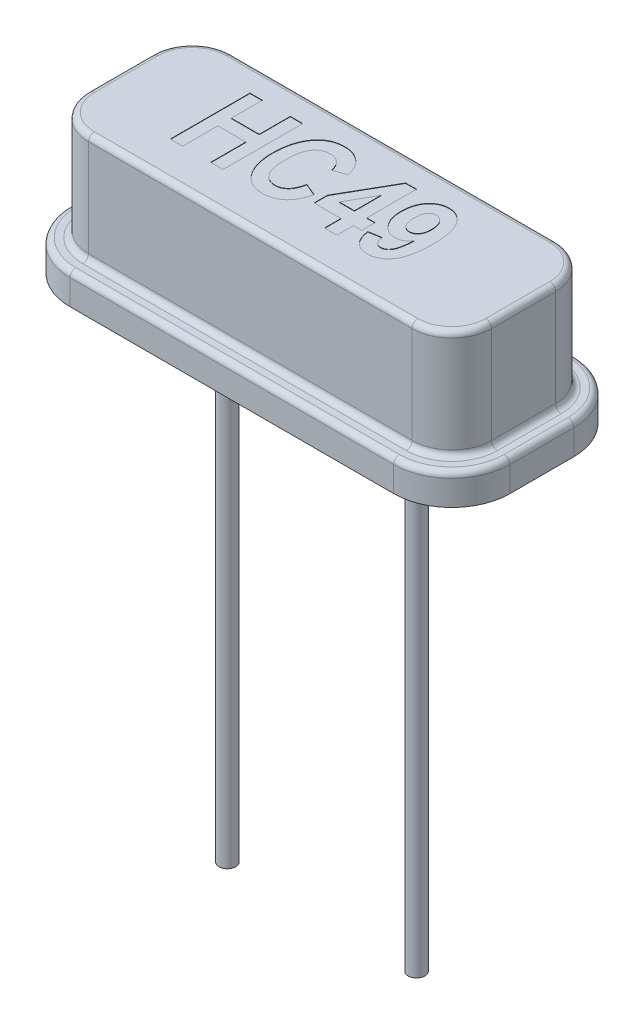
from build123d import *

# Parameters (mm, degrees)
BOSS_EXTRUDE1_DEPTH = 0.8
BOSS_EXTRUDE2_DEPTH = 2.8
FILLET1_R           = 0.15
SKETCH3_R           = 0.215
BOSS_EXTRUDE3_DEPTH = 12.7
CUT_EXTRUDE1_DEPTH  = 0.01
CUT_EXTRUDE3_START  = -0.02
SKETCH5_R           = 0.415
SKETCH5_R_2         = 0.215
CUT_EXTRUDE3_DEPTH  = 0.02


with BuildPart() as part:
    # Sketch1 → Boss-Extrude1 (new body)
    with BuildSketch(Plane(origin=(0, 0, 0), x_dir=(1, 0, 0), z_dir=(0, 1, 0))):
        with BuildLine():
            Line((5.675, -0.825), (5.675, 0.825))
            ThreePointArc((5.675, 0.825), (5.235660172, 1.885660172), (4.175, 2.325))
            Line((4.175, 2.325), (-4.175, 2.325))
            ThreePointArc((-4.175, 2.325), (-5.235660172, 1.885660172), (-5.675, 0.825))
            Line((-5.675, 0.825), (-5.675, -0.825))
            ThreePointArc((-5.675, -0.825), (-5.235660172, -1.885660172), (-4.175, -2.325))
            Line((-4.175, -2.325), (4.175, -2.325))
            ThreePointArc((4.175, -2.325), (5.235660172, -1.885660172), (5.675, -0.825))
        make_face()
    extrude(amount=BOSS_EXTRUDE1_DEPTH)

    # Sketch2 → Boss-Extrude2 (add)
    with BuildSketch(Plane(origin=(0, 0.8, 0), x_dir=(1, 0, 0), z_dir=(0, 1, 0))):
        with BuildLine():
            Line((-5.2, 0.825), (-5.2, -0.825))
            ThreePointArc((-5.2, -0.825), (-4.899784451, -1.549784451), (-4.175, -1.85))
            Line((-4.175, -1.85), (4.175, -1.85))
            ThreePointArc((4.175, -1.85), (4.899784451, -1.549784451), (5.2, -0.825))
            Line((5.2, -0.825), (5.2, 0.825))
            ThreePointArc((5.2, 0.825), (4.899784451, 1.549784451), (4.175, 1.85))
            Line((4.175, 1.85), (-4.175, 1.85))
            ThreePointArc((-4.175, 1.85), (-4.899784451, 1.549784451), (-5.2, 0.825))
        make_face()
    extrude(amount=BOSS_EXTRUDE2_DEPTH)

    # Fillet1
    fillet1_edges = [part.edges().sort_by_distance(p)[0] for p in [
        (5.235660172, 0.8, -1.885660172),
        (0, 0.8, -2.325),
        (-5.235660172, 0.8, -1.885660172),
        (-5.675, 0.8, 0),
        (-5.235660172, 0.8, 1.885660172),
        (0, 0.8, 2.325),
        (-4.899784451, 0.8, -1.549784451),
        (-5.2, 0.8, 0),
        (-4.899784451, 0.8, 1.549784451),
        (0, 0.8, 1.85),
        (4.899784451, 0.8, 1.549784451),
        (5.2, 0.8, 0),
        (4.899784451, 0.8, -1.549784451),
        (0, 0.8, -1.85),
        (-4.899784451, 3.6, -1.549784451),
        (-5.2, 3.6, 0),
        (-4.899784451, 3.6, 1.549784451),
        (0, 3.6, 1.85),
        (4.899784451, 3.6, 1.549784451),
        (5.2, 3.6, 0),
        (4.899784451, 3.6, -1.549784451),
        (0, 3.6, -1.85),
        (5.235660172, 0.8, 1.885660172),
        (5.675, 0.8, 0),
    ]]
    fillet(fillet1_edges, radius=FILLET1_R)

    # Sketch3 → Boss-Extrude3 (add)
    with BuildSketch(Plane.XZ):
        with Locations(Location((-2.44, 0, 0), (0, 0, 90))):
            Circle(SKETCH3_R)
        with Locations(Location((2.44, 0, 0), (0, 0, 90))):
            Circle(SKETCH3_R)
    extrude(amount=BOSS_EXTRUDE3_DEPTH)

    # Sketch4 → Cut-Extrude1 (cut)
    # profile 1 of 4: a face of its own
    with BuildSketch(Plane(origin=(0, 3.6, 0), x_dir=(1, 0, 0), z_dir=(0, 1, 0))):
        Polygon((-3.029081842, -0.884686759), (-3.029081842, 1.169968189), (-2.708875876, 1.169968189), (-2.708875876, 0.369453275), (-1.988412453, 0.369453275), (-1.988412453, 1.169968189), (-1.668206487, 1.169968189), (-1.668206487, -0.884686759), (-1.988412453, -0.884686759), (-1.988412453, 0.022563478), (-2.708875876, 0.022563478), (-2.708875876, -0.884686759), align=None)
    # profile 2 of 4: a face of its own
    with BuildSketch(Plane(origin=(0, 3.6, 0), x_dir=(1, 0, 0), z_dir=(0, 1, 0))):
        with BuildLine():
            Line((-0.253963471, -0.137539505), (0.066242495, -0.270958657))
            add(Edge.make_bspline(
                [(0.066242495, -0.270958657), (0.059629329, -0.297874919), (0.046743248, -0.350322583), (0.022364559, -0.425285037), (-0.004461404, -0.494838777), (-0.035151811, -0.558594485), (-0.068654448, -0.617111511), (-0.10586906, -0.669814027), (-0.14609549, -0.716971873), (-0.189562536, -0.75847486), (-0.236199704, -0.794184864), (-0.284697542, -0.826006102), (-0.336308407, -0.852092739), (-0.390309609, -0.874118891), (-0.447125694, -0.890491674), (-0.506324988, -0.902812871), (-0.568161588, -0.909863634), (-0.610286528, -0.91086262), (-0.631706446, -0.911370589)],
                knots=[0, 0, 0, 0, 1.282586353, 2.499182829, 3.646034602, 4.730797578, 5.771318175, 6.763713287, 7.712684321, 8.6363956, 9.539720391, 10.428356747, 11.317388874, 12.212151588, 13.124116906, 14.050177375, 15.008543639, 16, 16, 16, 16], degree=3))
            add(Edge.make_bspline(
                [(-0.631706446, -0.911370589), (-0.658581922, -0.910766362), (-0.711230344, -0.909582696), (-0.788054509, -0.896846744), (-0.861159321, -0.877496683), (-0.930413002, -0.849709875), (-0.995897673, -0.814192418), (-1.056921547, -0.77019883), (-1.114908561, -0.719366918), (-1.148624016, -0.679733007), (-1.165799991, -0.659541939)],
                knots=[0, 0, 0, 0, 1.053414494, 2.063614103, 3.046293227, 4.01520277, 4.983805463, 5.961130836, 6.961320097, 8, 8, 8, 8], degree=3))
            add(Edge.make_bspline(
                [(-1.165799991, -0.659541939), (-1.184679838, -0.634613531), (-1.222715036, -0.584392948), (-1.270466116, -0.501579296), (-1.311079326, -0.412609945), (-1.344319235, -0.317404257), (-1.370227992, -0.215856753), (-1.388341578, -0.107919024), (-1.399219338, 0.006356724), (-1.400641041, 0.084662455), (-1.401368182, 0.124712517)],
                knots=[0, 0, 0, 0, 0.898140554, 1.809387162, 2.740718204, 3.705966939, 4.703925369, 5.74945803, 6.848943185, 8, 8, 8, 8], degree=3))
            add(Edge.make_bspline(
                [(-1.401368182, 0.124712517), (-1.400703886, 0.166991019), (-1.399409949, 0.249342447), (-1.387760008, 0.369238299), (-1.370000172, 0.482271551), (-1.343520994, 0.588022079), (-1.310349991, 0.687097108), (-1.269367312, 0.778878823), (-1.221782309, 0.864327117), (-1.182958386, 0.915359721), (-1.163715316, 0.940654021)],
                knots=[0, 0, 0, 0, 1.171098873, 2.281104103, 3.334483992, 4.338438261, 5.297974877, 6.225356982, 7.120398547, 8, 8, 8, 8], degree=3))
            add(Edge.make_bspline(
                [(-1.163715316, 0.940654021), (-1.14624356, 0.961100474), (-1.111810476, 1.001396047), (-1.052956144, 1.053575983), (-0.989728113, 1.097930786), (-0.922149262, 1.134246104), (-0.849917201, 1.162490972), (-0.773385451, 1.182420991), (-0.692247593, 1.194180501), (-0.636748668, 1.195815588), (-0.608358094, 1.19665202)],
                knots=[0, 0, 0, 0, 1.017460211, 2.005195831, 2.96880208, 3.936538458, 4.903086366, 5.898753713, 6.925103759, 8, 8, 8, 8], degree=3))
            add(Edge.make_bspline(
                [(-0.608358094, 1.19665202), (-0.585124248, 1.196095887), (-0.539459214, 1.195002834), (-0.472499721, 1.186264476), (-0.408704342, 1.170899294), (-0.347450341, 1.150744971), (-0.289275127, 1.123778694), (-0.234010487, 1.09105669), (-0.181439089, 1.05268654), (-0.149574733, 1.022857328), (-0.133469299, 1.007780532)],
                knots=[0, 0, 0, 0, 1.062174293, 2.087653736, 3.080296642, 4.058948008, 5.03139012, 6.005719887, 6.992016441, 8, 8, 8, 8], degree=3))
            add(Edge.make_bspline(
                [(-0.133469299, 1.007780532), (-0.122271346, 0.996160574), (-0.099453069, 0.972482366), (-0.068728208, 0.932597904), (-0.040282317, 0.888672899), (-0.014625402, 0.840519899), (0.009227018, 0.788609546), (0.03091643, 0.732675751), (0.049997069, 0.672591265), (0.060743697, 0.630926592), (0.066242495, 0.609607749)],
                knots=[0, 0, 0, 0, 0.858002413, 1.748367619, 2.673305357, 3.63929672, 4.648357542, 5.711115493, 6.828831091, 8, 8, 8, 8], degree=3))
            Line((0.066242495, 0.609607749), (-0.253963471, 0.502872427))
            add(Edge.make_bspline(
                [(-0.253963471, 0.502872427), (-0.256972429, 0.516538402), (-0.262827362, 0.543130121), (-0.274582578, 0.581505589), (-0.288894084, 0.617148772), (-0.30446519, 0.650915336), (-0.323215394, 0.681637347), (-0.342828697, 0.710782723), (-0.365827132, 0.736604396), (-0.390124342, 0.760459193), (-0.416577358, 0.781073692), (-0.443654397, 0.79971629), (-0.472162731, 0.815216244), (-0.501983443, 0.827682104), (-0.532763332, 0.837770752), (-0.564731756, 0.844865337), (-0.597815555, 0.849161577), (-0.620297112, 0.849560017), (-0.631706446, 0.849762223)],
                knots=[0, 0, 0, 0, 1.200071046, 2.335138942, 3.437621639, 4.493482591, 5.51985659, 6.521917265, 7.50210956, 8.480124453, 9.438987346, 10.374745328, 11.297656865, 12.216555725, 13.143999084, 14.072438006, 15.021767148, 16, 16, 16, 16], degree=3))
            add(Edge.make_bspline(
                [(-0.631706446, 0.849762223), (-0.647853485, 0.849283482), (-0.679632509, 0.84834127), (-0.726191515, 0.840844836), (-0.77024266, 0.827585736), (-0.81244915, 0.81017915), (-0.852101757, 0.786988393), (-0.889641908, 0.758904059), (-0.924060188, 0.725077422), (-0.957046479, 0.687028259), (-0.98693764, 0.642943524), (-1.012317277, 0.591993291), (-1.03325087, 0.534359456), (-1.051282692, 0.470455362), (-1.064773811, 0.399861154), (-1.074136233, 0.322686152), (-1.079979439, 0.239042271), (-1.08075889, 0.181008756), (-1.081162216, 0.150979412)],
                knots=[0, 0, 0, 0, 0.827686898, 1.628972485, 2.409099021, 3.181967192, 3.964173723, 4.757978677, 5.579415306, 6.433460257, 7.33665582, 8.302235029, 9.343905073, 10.476376866, 11.703364719, 13.024698166, 14.460435141, 16, 16, 16, 16], degree=3))
            add(Edge.make_bspline(
                [(-1.081162216, 0.150979412), (-1.080706478, 0.119842528), (-1.079828865, 0.05988232), (-1.07471309, -0.02672032), (-1.064989214, -0.10628831), (-1.052541914, -0.179134517), (-1.03550895, -0.244833149), (-1.014699895, -0.303424444), (-0.990731174, -0.355480409), (-0.96213906, -0.40031806), (-0.930458432, -0.439026302), (-0.896776131, -0.472633489), (-0.860441882, -0.500707618), (-0.822427721, -0.524500281), (-0.781690007, -0.54252973), (-0.738710684, -0.554796563), (-0.693744647, -0.563280936), (-0.662878274, -0.564075485), (-0.647133035, -0.564480793)],
                knots=[0, 0, 0, 0, 1.588381619, 3.058741945, 4.422565575, 5.675514383, 6.825848758, 7.879737597, 8.8437938, 9.742560847, 10.584031071, 11.391113559, 12.163968987, 12.921455088, 13.673648094, 14.427376256, 15.197789283, 16, 16, 16, 16], degree=3))
            add(Edge.make_bspline(
                [(-0.647133035, -0.564480793), (-0.635585232, -0.56412315), (-0.612677626, -0.563413688), (-0.578968885, -0.558896039), (-0.546440515, -0.550818568), (-0.515088129, -0.539611992), (-0.485045351, -0.524826347), (-0.456003941, -0.507309651), (-0.428550571, -0.486254392), (-0.401972893, -0.46234718), (-0.376905347, -0.434849661), (-0.353995526, -0.40323526), (-0.332709713, -0.368069006), (-0.31317659, -0.329132804), (-0.295271582, -0.286676903), (-0.279484628, -0.240375506), (-0.2651989, -0.190459772), (-0.257780751, -0.155519367), (-0.253963471, -0.137539505)],
                knots=[0, 0, 0, 0, 0.874040642, 1.73385169, 2.568061146, 3.406503852, 4.248567505, 5.09821747, 5.96915136, 6.862782357, 7.800986125, 8.779254107, 9.812897901, 10.908933612, 12.073249979, 13.297367906, 14.609261928, 16, 16, 16, 16], degree=3))
        make_face()
    # profile 3 of 4: a face of its own
    with BuildSketch(Plane(origin=(0, 3.6, 0), x_dir=(1, 0, 0), z_dir=(0, 1, 0))):
        Polygon((0.946808902, -0.884686759), (0.946808902, -0.457745471), (0.253029309, -0.457745471), (0.253029309, -0.112106479), (0.988502387, 1.169968189), (1.267014867, 1.169968189), (1.267014867, -0.110855674), (1.480485511, -0.110855674), (1.480485511, -0.457745471), (1.267014867, -0.457745471), (1.267014867, -0.884686759), align=None)
        Polygon((0.946808902, -0.110855674), (0.946808902, 0.579171505), (0.557808685, -0.110855674), align=None, mode=Mode.SUBTRACT)
    # profile 4 of 4: a face of its own
    with BuildSketch(Plane(origin=(0, 3.6, 0), x_dir=(1, 0, 0), z_dir=(0, 1, 0))):
        with BuildLine():
            Line((1.587220833, -0.40437781), (1.907426799, -0.351010149))
            add(Edge.make_bspline(
                [(1.907426799, -0.351010149), (1.909769747, -0.369848076), (1.914190636, -0.405393209), (1.92706889, -0.454633937), (1.944362671, -0.496610615), (1.966587206, -0.531220747), (1.993840641, -0.558545578), (2.026332684, -0.57750594), (2.063264305, -0.589287784), (2.089396259, -0.590523033), (2.102969245, -0.591164623)],
                knots=[0, 0, 0, 0, 1.319326323, 2.489426106, 3.529051563, 4.464831828, 5.333004823, 6.186850188, 7.058246609, 8, 8, 8, 8], degree=3))
            add(Edge.make_bspline(
                [(2.102969245, -0.591164623), (2.112451317, -0.59089793), (2.131160683, -0.590371711), (2.158434221, -0.584565974), (2.184581476, -0.576093581), (2.208838951, -0.562962571), (2.232645035, -0.547824274), (2.254197501, -0.527884061), (2.274182767, -0.504532945), (2.294173256, -0.477950885), (2.31157513, -0.444965996), (2.327882824, -0.405692832), (2.341671768, -0.3587628), (2.35465515, -0.304824185), (2.364991864, -0.243319352), (2.37485776, -0.174836625), (2.381984271, -0.098837961), (2.385760571, -0.045682132), (2.387735748, -0.017879202)],
                knots=[0, 0, 0, 0, 0.644543862, 1.271769083, 1.891165802, 2.509042881, 3.144141085, 3.807375218, 4.498117987, 5.236232557, 6.066162346, 7.029127285, 8.127602092, 9.392182276, 10.80471919, 12.371711283, 14.102239018, 16, 16, 16, 16], degree=3))
            add(Edge.make_bspline(
                [(2.387735748, -0.017879202), (2.377183619, -0.031605537), (2.356620395, -0.058354424), (2.321734313, -0.093396094), (2.285133023, -0.123512335), (2.246447773, -0.148247182), (2.205279137, -0.167188795), (2.162239193, -0.181158696), (2.11673776, -0.189067248), (2.085765, -0.190287367), (2.070031391, -0.190907166)],
                knots=[0, 0, 0, 0, 1.102789804, 2.14903684, 3.143943928, 4.119731724, 5.067111426, 6.025365756, 6.996921053, 8, 8, 8, 8], degree=3))
            add(Edge.make_bspline(
                [(2.070031391, -0.190907166), (2.053459384, -0.19032196), (2.020660075, -0.189163722), (1.972310832, -0.180638599), (1.925571738, -0.166300678), (1.880231893, -0.146101586), (1.836393323, -0.119927954), (1.793599054, -0.088603977), (1.752817434, -0.051160215), (1.713702445, -0.008788758), (1.677592239, 0.038290127), (1.646187051, 0.089880398), (1.619911465, 0.145298621), (1.598225968, 0.204344357), (1.581127687, 0.266957266), (1.569065528, 0.333348854), (1.562007063, 0.403488019), (1.561034746, 0.451573137), (1.560537003, 0.476188597)],
                knots=[0, 0, 0, 0, 0.853008317, 1.688273699, 2.518990207, 3.364703856, 4.237267487, 5.143228359, 6.090523348, 7.083087898, 8.109260898, 9.140138569, 10.186765902, 11.262156596, 12.374895713, 13.52439355, 14.732701641, 16, 16, 16, 16], degree=3))
            add(Edge.make_bspline(
                [(1.560537003, 0.476188597), (1.560971306, 0.502477745), (1.561816513, 0.553639726), (1.569696472, 0.628133525), (1.581231576, 0.698419667), (1.599115074, 0.764114648), (1.620883033, 0.825930835), (1.648732706, 0.883114163), (1.68068511, 0.936475205), (1.71791496, 0.984744798), (1.758748806, 1.027958779), (1.801917587, 1.066169895), (1.84787762, 1.097939843), (1.895503744, 1.124753361), (1.946119648, 1.144655393), (1.998762017, 1.159324915), (2.053878039, 1.168366951), (2.091399871, 1.169428534), (2.110474072, 1.169968189)],
                knots=[0, 0, 0, 0, 1.272215089, 2.475890183, 3.622894807, 4.716319483, 5.767639782, 6.790746357, 7.789970851, 8.773649814, 9.735058129, 10.664800405, 11.55880235, 12.435110674, 13.304652037, 14.184465815, 15.077074305, 16, 16, 16, 16], degree=3))
            add(Edge.make_bspline(
                [(2.110474072, 1.169968189), (2.131795804, 1.169298572), (2.173636269, 1.167984556), (2.234763939, 1.156064707), (2.293302118, 1.138044484), (2.348539939, 1.111210491), (2.401342962, 1.077727613), (2.450467557, 1.035770599), (2.497471616, 0.987329388), (2.540977906, 0.930887037), (2.581227489, 0.866258183), (2.615015825, 0.791221521), (2.644082872, 0.706780707), (2.667599752, 0.61258455), (2.685637093, 0.50874517), (2.698823885, 0.395169156), (2.706721563, 0.271725315), (2.70752523, 0.186152995), (2.707941714, 0.141806846)],
                knots=[0, 0, 0, 0, 0.768639044, 1.508330316, 2.239523137, 2.973051276, 3.717335632, 4.489809939, 5.298473002, 6.149152485, 7.056611256, 8.039471524, 9.111627666, 10.27567474, 11.538846826, 12.912365996, 14.399895221, 16, 16, 16, 16], degree=3))
            add(Edge.make_bspline(
                [(2.707941714, 0.141806846), (2.707322773, 0.09663097), (2.706129588, 0.00954173), (2.69870217, -0.116203379), (2.684240908, -0.231929313), (2.665781462, -0.33812316), (2.640512822, -0.434314697), (2.611194148, -0.521299314), (2.574767711, -0.597929627), (2.533291929, -0.665039932), (2.486948447, -0.722876884), (2.437613855, -0.773129197), (2.385438348, -0.81651641), (2.328860007, -0.850521431), (2.269805875, -0.878276622), (2.207017935, -0.897231897), (2.141108962, -0.909448023), (2.095937071, -0.910722189), (2.072949935, -0.911370589)],
                knots=[0, 0, 0, 0, 1.571453096, 3.02941894, 4.378519311, 5.626358941, 6.775415943, 7.834882386, 8.814409009, 9.719848686, 10.572957728, 11.386527197, 12.166440075, 12.925873884, 13.676424396, 14.430252538, 15.201184667, 16, 16, 16, 16], degree=3))
            add(Edge.make_bspline(
                [(2.072949935, -0.911370589), (2.05694639, -0.910968575), (2.025664094, -0.910182755), (1.97979398, -0.904060575), (1.935954423, -0.894850135), (1.894562462, -0.880655589), (1.854792028, -0.863870172), (1.817886903, -0.841756339), (1.782427268, -0.816754009), (1.749410427, -0.787414099), (1.719005134, -0.753980095), (1.691159991, -0.716525525), (1.666634481, -0.674636603), (1.645202918, -0.628561496), (1.625610804, -0.57874615), (1.610280244, -0.524293711), (1.59663556, -0.465913353), (1.59041836, -0.425277149), (1.587220833, -0.40437781)],
                knots=[0, 0, 0, 0, 0.986553809, 1.928426861, 2.849680083, 3.744069761, 4.623008842, 5.506449348, 6.391177699, 7.295815905, 8.224019682, 9.17365961, 10.168776031, 11.211579283, 12.30503203, 13.465838605, 14.696672049, 16, 16, 16, 16], degree=3))
        make_face()
        with BuildLine():
            add(Edge.make_bspline(
                [(2.361051918, 0.466599095), (2.360845903, 0.481620052), (2.360446536, 0.510738609), (2.356396019, 0.553021757), (2.351052454, 0.592722541), (2.341928044, 0.62952411), (2.331437446, 0.664059523), (2.317499865, 0.695594967), (2.301812809, 0.724728929), (2.283201014, 0.75055947), (2.263448784, 0.773630871), (2.24287933, 0.79397248), (2.221553081, 0.811004949), (2.199770167, 0.825652502), (2.176906492, 0.836313168), (2.153527622, 0.843986063), (2.129566412, 0.848737213), (2.113274971, 0.849418453), (2.105053919, 0.849762223)],
                knots=[0, 0, 0, 0, 1.410667698, 2.734619817, 3.988403144, 5.169655862, 6.292835804, 7.374652675, 8.403152855, 9.395805716, 10.358820443, 11.25441881, 12.108810097, 12.920008583, 13.714324055, 14.469922495, 15.227886234, 16, 16, 16, 16], degree=3))
            add(Edge.make_bspline(
                [(2.105053919, 0.849762223), (2.089484552, 0.848895657), (2.058915176, 0.847194214), (2.015544811, 0.830746069), (1.976626318, 0.804399156), (1.948433686, 0.774634609), (1.928695032, 0.745739881), (1.915682603, 0.719948324), (1.905241178, 0.690705877), (1.895688927, 0.658378598), (1.88952101, 0.622529862), (1.88448023, 0.583451055), (1.880951619, 0.541015408), (1.880814181, 0.511496503), (1.880742969, 0.496201469)],
                knots=[0, 0, 0, 0, 1.187290174, 2.331162128, 3.496193294, 4.759847015, 5.441192392, 6.168848931, 6.962943298, 7.814554474, 8.744801334, 9.741994443, 10.83002875, 12, 12, 12, 12], degree=3))
            add(Edge.make_bspline(
                [(1.880742969, 0.496201469), (1.881000178, 0.480907698), (1.881498865, 0.451255604), (1.884832466, 0.408377806), (1.890177886, 0.368686858), (1.897531986, 0.332095351), (1.907531975, 0.298773503), (1.91953542, 0.268554368), (1.933808235, 0.241569906), (1.955032948, 0.210504922), (1.985614506, 0.178467038), (2.027441301, 0.149948021), (2.073812491, 0.132121749), (2.106427482, 0.130249242), (2.122982118, 0.1292988)],
                knots=[0, 0, 0, 0, 1.117621737, 2.166883761, 3.140735737, 4.043058164, 4.891347361, 5.67969764, 6.415740424, 7.117195544, 8.424575897, 9.624581875, 10.794291212, 12, 12, 12, 12], degree=3))
            add(Edge.make_bspline(
                [(2.122982118, 0.1292988), (2.138827297, 0.130332017), (2.170227814, 0.132379552), (2.21523363, 0.149266818), (2.256315562, 0.176263504), (2.28678083, 0.20663047), (2.307775723, 0.236160365), (2.322810215, 0.26107536), (2.333872958, 0.2893536), (2.344408606, 0.319498256), (2.351405384, 0.352743641), (2.357614883, 0.388284927), (2.360117826, 0.426679204), (2.360733211, 0.452978643), (2.361051918, 0.466599095)],
                knots=[0, 0, 0, 0, 1.232367425, 2.442192132, 3.695339749, 5.043694926, 5.765386029, 6.517970574, 7.304718348, 8.126994847, 9.004852303, 9.948880001, 10.937727086, 12, 12, 12, 12], degree=3))
        make_face(mode=Mode.SUBTRACT)
    extrude(amount=-CUT_EXTRUDE1_DEPTH, mode=Mode.SUBTRACT)

    # Sketch5 → Cut-Extrude3 (cut)
    # profile 1 of 2: a face of its own
    with BuildSketch(Plane.XZ.offset(CUT_EXTRUDE3_START)):
        with Locations(Location((-2.44, 0, 0), (0, 0, 270))):
            Circle(SKETCH5_R)
        with Locations(Location((-2.44, 0, 0), (0, 0, 270))):
            Circle(SKETCH5_R_2, mode=Mode.SUBTRACT)
    # profile 2 of 2: a face of its own
    with BuildSketch(Plane.XZ.offset(CUT_EXTRUDE3_START)):
        with Locations(Location((2.44, 0, 0), (0, 0, 270))):
            Circle(SKETCH5_R)
        with Locations(Location((2.44, 0, 0), (0, 0, 270))):
            Circle(SKETCH5_R_2, mode=Mode.SUBTRACT)
    extrude(amount=CUT_EXTRUDE3_DEPTH, mode=Mode.SUBTRACT)


solid = part.part
